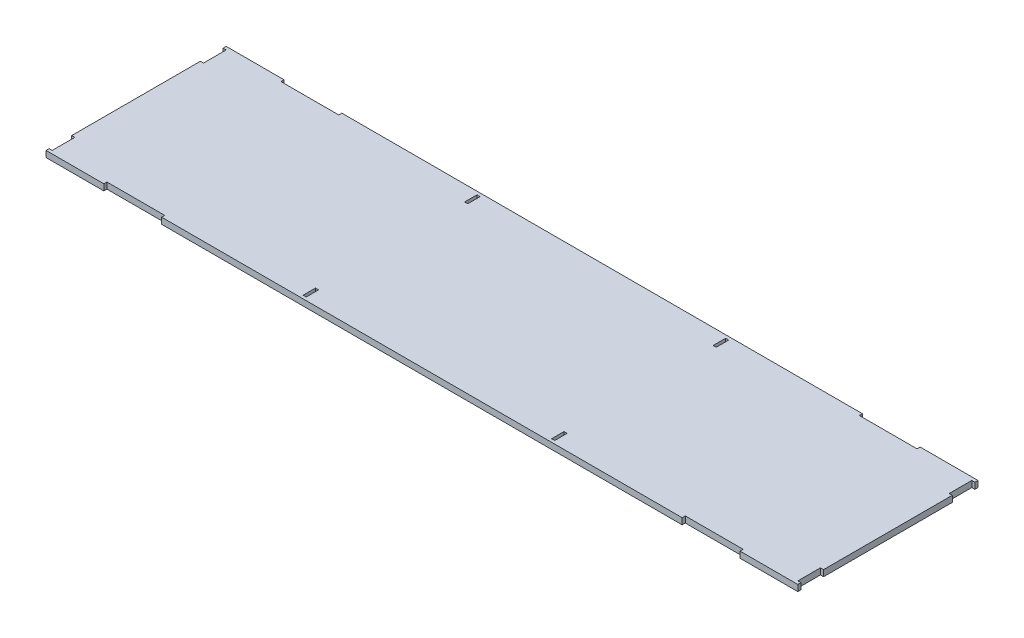
from build123d import *

# Parameters (mm, degrees)
SKETCH1_W           = 55.928846154
SKETCH1_H           = 3.175
SKETCH1_W_2         = 3.175
SKETCH1_W_3         = 59.103846154
SKETCH1_H_2         = 26.307142857
SKETCH1_H_3         = 26.307142858
BOSS_EXTRUDE1_DEPTH = 6.35
SKETCH2_W           = 3.175
SKETCH2_H           = 12.7
CUT_EXTRUDE1_DEPTH  = 396.105756412
SKETCH3_W           = 59.103846153
SKETCH3_H           = 3.175
SKETCH3_W_2         = 59.103846154
SKETCH3_W_3         = 3.175
SKETCH3_H_2         = 26.307142857
BOSS_EXTRUDE2_DEPTH = 6.35


with BuildPart() as part:
    # Sketch1 → Boss-Extrude1 (new body)
    with BuildSketch(Plane(origin=(0, 0, 0), x_dir=(1, 0, 0), z_dir=(0, 1, 0))):
        Polygon((0, -88.9), (0, 88.9), (-29.551923077, 88.9), (-88.655769231, 88.9), (-147.759615385, 88.9), (-206.863461538, 88.9), (-265.967307692, 88.9), (-325.071153846, 88.9), (-381, 88.9), (-381, 65.767857143), (-381, 39.460714286), (-381, 13.153571429), (-381, -13.153571429), (-381, -39.460714286), (-381, -65.767857143), (-381, -88.9), (-325.071153846, -88.9), (-265.967307692, -88.9), (-206.863461538, -88.9), (-147.759615385, -88.9), (-88.655769231, -88.9), (-29.551923077, -88.9), align=None)
        Polygon((29.551923077, 88.9), (0, 88.9), (0, -88.9), (29.551923077, -88.9), (88.655769231, -88.9), (147.759615385, -88.9), (206.863461538, -88.9), (265.967307692, -88.9), (325.071153846, -88.9), (381, -88.9), (381, -65.767857143), (381, -39.460714286), (381, -13.153571429), (381, 13.153571429), (381, 39.460714286), (381, 65.767857143), (381, 88.9), (325.071153846, 88.9), (265.967307692, 88.9), (206.863461538, 88.9), (147.759615385, 88.9), (88.655769231, 88.9), align=None)
        with Locations((-353.035576923, -90.4875)):
            Rectangle(SKETCH1_W, SKETCH1_H)
        with Locations((-382.5875, -90.4875)):
            Rectangle(SKETCH1_W_2, SKETCH1_H)
        with Locations((-236.415384615, -90.4875)):
            Rectangle(SKETCH1_W_3, SKETCH1_H)
        with Locations((-382.5875, -52.614285714)):
            Rectangle(SKETCH1_W_2, SKETCH1_H_2)
        with Locations((-118.207692308, -90.4875)):
            Rectangle(SKETCH1_W_3, SKETCH1_H)
        with Locations((-382.5875, 0)):
            Rectangle(SKETCH1_W_2, SKETCH1_H_3)
        with Locations((-382.5875, 52.614285714)):
            Rectangle(SKETCH1_W_2, SKETCH1_H_2)
        with Locations((-382.5875, 90.4875)):
            Rectangle(SKETCH1_W_2, SKETCH1_H)
        with Locations((-353.035576923, 90.4875)):
            Rectangle(SKETCH1_W, SKETCH1_H)
        with Locations((-236.415384615, 90.4875)):
            Rectangle(SKETCH1_W_3, SKETCH1_H)
        with Locations((-118.207692308, 90.4875)):
            Rectangle(SKETCH1_W_3, SKETCH1_H)
        Polygon((-29.551923077, 88.9), (0, 88.9), (29.551923077, 88.9), (29.551923077, 92.075), (-29.551923077, 92.075), align=None)
        with Locations((118.207692308, 90.4875)):
            Rectangle(SKETCH1_W_3, SKETCH1_H)
        Polygon((29.551923077, -88.9), (0, -88.9), (-29.551923077, -88.9), (-29.551923077, -92.075), (29.551923077, -92.075), align=None)
        with Locations((118.207692308, -90.4875)):
            Rectangle(SKETCH1_W_3, SKETCH1_H)
        with Locations((236.415384615, -90.4875)):
            Rectangle(SKETCH1_W_3, SKETCH1_H)
        with Locations((236.415384615, 90.4875)):
            Rectangle(SKETCH1_W_3, SKETCH1_H)
        with Locations((382.5875, 90.4875)):
            Rectangle(SKETCH1_W_2, SKETCH1_H)
        with Locations((382.5875, 52.614285714)):
            Rectangle(SKETCH1_W_2, SKETCH1_H_2)
        with Locations((382.5875, 0)):
            Rectangle(SKETCH1_W_2, SKETCH1_H_3)
        with Locations((382.5875, -52.614285714)):
            Rectangle(SKETCH1_W_2, SKETCH1_H_2)
        with Locations((382.5875, -90.4875)):
            Rectangle(SKETCH1_W_2, SKETCH1_H)
        with Locations((354.623076923, -90.4875)):
            Rectangle(SKETCH1_W_3, SKETCH1_H)
        with Locations((354.623076923, 90.4875)):
            Rectangle(SKETCH1_W_3, SKETCH1_H)
    extrude(amount=BOSS_EXTRUDE1_DEPTH)

    # Sketch2 → Cut-Extrude1 (cut, through all)
    with BuildSketch(Plane(origin=(0, 6.35, 0), x_dir=(1, 0, 0), z_dir=(0, 1, 0))):
        with Locations((-123.03125, 82.55)):
            Rectangle(SKETCH2_W, SKETCH2_H)
        with Locations((-123.03125, -82.55)):
            Rectangle(SKETCH2_W, SKETCH2_H)
        with Locations((130.96875, 82.55)):
            Rectangle(SKETCH2_W, SKETCH2_H)
        with Locations((130.96875, -82.55)):
            Rectangle(SKETCH2_W, SKETCH2_H)
    extrude(amount=-CUT_EXTRUDE1_DEPTH, mode=Mode.SUBTRACT)

    # Sketch3 → Boss-Extrude2 (add)
    with BuildSketch(Plane(origin=(0, 6.35, 0), x_dir=(1, 0, 0), z_dir=(0, 1, 0))):
        with Locations((-177.311538462, -90.4875)):
            Rectangle(SKETCH3_W, SKETCH3_H)
        with Locations((-59.103846154, -90.4875)):
            Rectangle(SKETCH3_W_2, SKETCH3_H)
        with Locations((59.103846154, -90.4875)):
            Rectangle(SKETCH3_W_2, SKETCH3_H)
        with Locations((177.311538462, -90.4875)):
            Rectangle(SKETCH3_W, SKETCH3_H)
        with Locations((382.5875, -26.307142858)):
            Rectangle(SKETCH3_W_3, SKETCH3_H_2)
        with Locations((382.5875, 26.307142858)):
            Rectangle(SKETCH3_W_3, SKETCH3_H_2)
        with Locations((-382.5875, -26.307142858)):
            Rectangle(SKETCH3_W_3, SKETCH3_H_2)
        with Locations((-382.5875, 26.307142858)):
            Rectangle(SKETCH3_W_3, SKETCH3_H_2)
        with Locations((-177.311538462, 90.4875)):
            Rectangle(SKETCH3_W, SKETCH3_H)
        with Locations((-59.103846154, 90.4875)):
            Rectangle(SKETCH3_W_2, SKETCH3_H)
        with Locations((59.103846154, 90.4875)):
            Rectangle(SKETCH3_W_2, SKETCH3_H)
        with Locations((177.311538462, 90.4875)):
            Rectangle(SKETCH3_W, SKETCH3_H)
    extrude(amount=-BOSS_EXTRUDE2_DEPTH)


solid = part.part
